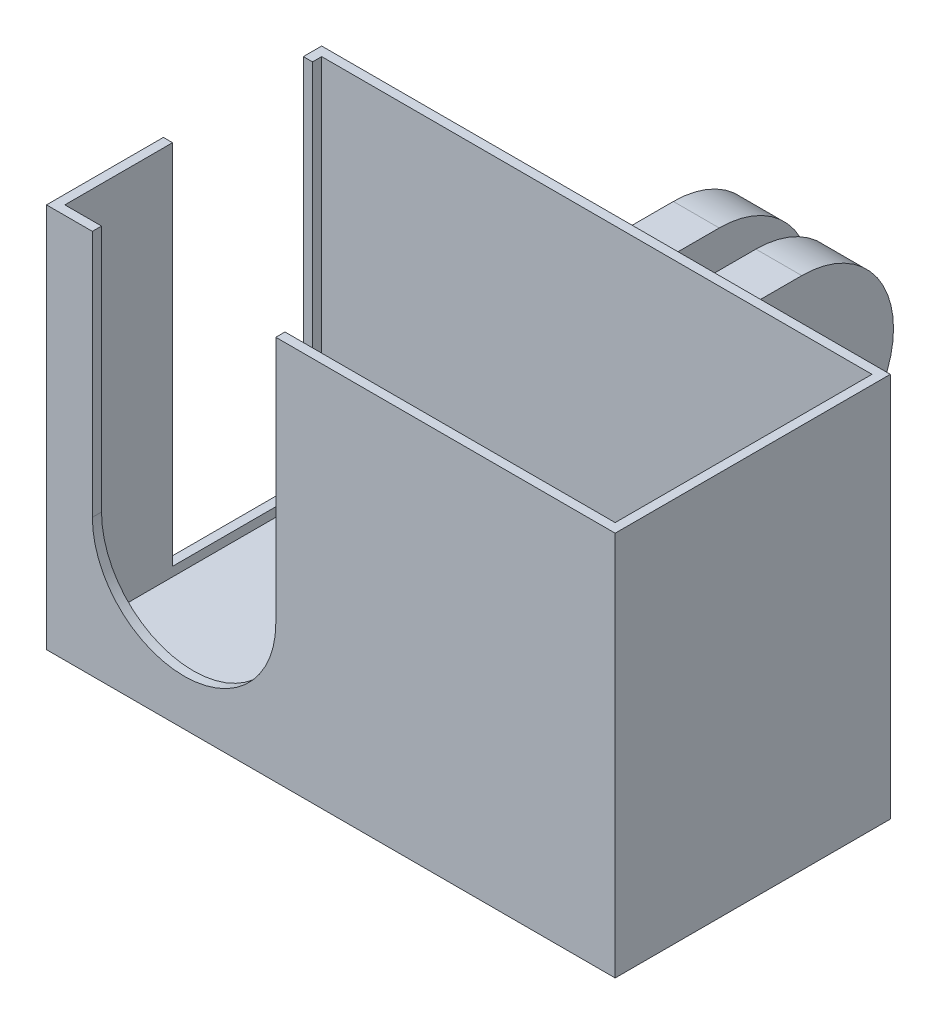
from build123d import *

# Parameters (mm, degrees)
SKETCH1_W           = 62
SKETCH1_H           = 42
BOSS_EXTRUDE1_DEPTH = 30
SKETCH2_R           = 10
CUT_EXTRUDE1_DEPTH  = 6
CUT_EXTRUDE2_START  = -2
SKETCH3_W           = 60
SKETCH3_H           = 40
CUT_EXTRUDE2_DEPTH  = 27
CUT_EXTRUDE3_REACH  = 62.547
SKETCH4_W           = 60
SKETCH4_H           = 28
SKETCH5_W           = 20
SKETCH5_H           = 1
CUT_EXTRUDE4_DEPTH  = 27
BOSS_EXTRUDE2_START = 2
BOSS_EXTRUDE2_DEPTH = 5
BOSS_EXTRUDE3_START = -7
BOSS_EXTRUDE3_DEPTH = 5
SKETCH10_W          = 15.255500618
SKETCH10_H          = 40
CUT_EXTRUDE5_DEPTH  = 1


with BuildPart() as part:
    # Sketch1 → Boss-Extrude1 (new body)
    with BuildSketch(Plane.XY):
        with Locations((0.653781513, -2.494957983)):
            Rectangle(SKETCH1_W, SKETCH1_H)
    extrude(amount=BOSS_EXTRUDE1_DEPTH)

    # Sketch2 → Cut-Extrude1 (cut)
    with BuildSketch(Plane.XY.offset(30)):
        with Locations((-15.346218487, -8.494957983)):
            Circle(SKETCH2_R)
    extrude(amount=-CUT_EXTRUDE1_DEPTH, mode=Mode.SUBTRACT)

    # Sketch3 → Cut-Extrude2 (cut)
    with BuildSketch(Plane.XY.offset(30).offset(CUT_EXTRUDE2_START)):
        with Locations((0.653781513, -2.494957983)):
            Rectangle(SKETCH3_W, SKETCH3_H)
    extrude(amount=-CUT_EXTRUDE2_DEPTH, mode=Mode.SUBTRACT)

    # Cut-Extrude3: up to this face of the body (flat: up to its plane)
    cut_extrude3_end = Plane(part.part.faces().sort_by_distance((0.653781513, -22.494957983, 14.5))[0])
    # Sketch4 → Cut-Extrude3 (cut, up to the picked face)
    with BuildSketch(Plane(origin=(0, 18.505042017, 0), x_dir=(1, 0, 0), z_dir=(0, 1, 0)), mode=Mode.PRIVATE) as cut_extrude3_sk1:
        with Locations((0.653781513, -15)):
            Rectangle(SKETCH4_W, SKETCH4_H)
    cut_extrude3_tool1 = split(extrude(cut_extrude3_sk1.sketch, amount=-CUT_EXTRUDE3_REACH, mode=Mode.PRIVATE), bisect_by=cut_extrude3_end, keep=Keep.BOTH, mode=Mode.PRIVATE)
    add(cut_extrude3_tool1.solids().sort_by(Axis((0.653782, 18.505042, 15), (0, -1, 0)))[0], mode=Mode.SUBTRACT)

    # Sketch5 → Cut-Extrude4 (cut)
    with BuildSketch(Plane(origin=(0, 18.505042017, 0), x_dir=(1, 0, 0), z_dir=(0, 1, 0))):
        with Locations((-15.346218487, -29.5)):
            Rectangle(SKETCH5_W, SKETCH5_H)
    extrude(amount=-CUT_EXTRUDE4_DEPTH, mode=Mode.SUBTRACT)

    # Sketch7 → Boss-Extrude2 (add)
    with BuildSketch(Plane(origin=(0, 0, 0), x_dir=(0, 0, -1), z_dir=(1, 0, 0)).offset(BOSS_EXTRUDE2_START)):
        with BuildLine():
            Line((0, 7.999642933), (15, 7.999642933))
            ThreePointArc((15, 7.999642933), (25, -2.000357067), (15, -12.000357067))
            Line((15, -12.000357067), (0, -12.000357067))
            Line((0, -12.000357067), (0, 7.999642933))
        make_face()
    extrude(amount=BOSS_EXTRUDE2_DEPTH)

    # Sketch8 → Boss-Extrude3 (add)
    with BuildSketch(Plane(origin=(0, 0, 0), x_dir=(0, 0, -1), z_dir=(1, 0, 0)).offset(BOSS_EXTRUDE3_START)):
        with BuildLine():
            Line((0, -12.000357067), (0, 7.999642933))
            Line((0, 7.999642933), (15, 7.999642933))
            ThreePointArc((15, 7.999642933), (25, -2.000357067), (15, -12.000357067))
            Line((15, -12.000357067), (0, -12.000357067))
        make_face()
    extrude(amount=BOSS_EXTRUDE3_DEPTH)

    # Sketch10 → Cut-Extrude5 (cut)
    with BuildSketch(Plane.ZY.offset(30.346218487)):
        with Locations((9.627750309, -1.494957983)):
            Rectangle(SKETCH10_W, SKETCH10_H)
    extrude(amount=-CUT_EXTRUDE5_DEPTH, mode=Mode.SUBTRACT)


solid = part.part
